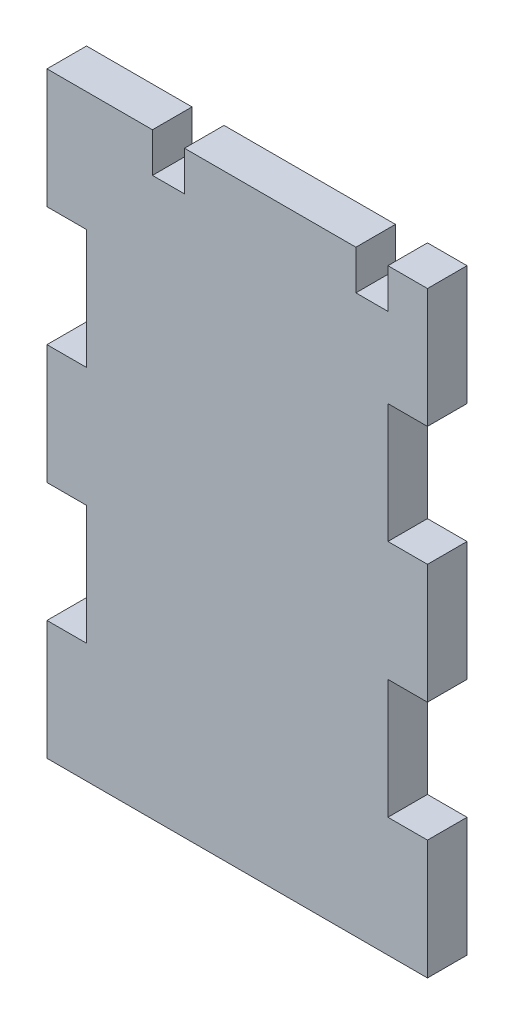
from build123d import *

# Parameters (mm, degrees)
SKETCH1_W           = 51.308
SKETCH1_H           = 80.518
BOSS_EXTRUDE1_DEPTH = 5.334
SKETCH2_W           = 5.334
SKETCH2_H           = 16.1036
CUT_EXTRUDE1_DEPTH  = 57.679185374
SKETCH3_W           = 4.318
SKETCH3_H           = 5.334
CUT_EXTRUDE2_DEPTH  = 57.679185374


with BuildPart() as part:
    # Sketch1 → Boss-Extrude1 (new body)
    with BuildSketch(Plane.XY):
        with Locations((-13.293278732, 0.572213281)):
            Rectangle(SKETCH1_W, SKETCH1_H)
    extrude(amount=BOSS_EXTRUDE1_DEPTH)

    # Sketch2 → Cut-Extrude1 (cut, through all)
    with BuildSketch(Plane.XY.offset(5.334)):
        with Locations((-36.280278732, 16.675813281)):
            Rectangle(SKETCH2_W, SKETCH2_H)
        with Locations((-36.280278732, -15.531386719)):
            Rectangle(SKETCH2_W, SKETCH2_H)
        with Locations((9.693721268, -15.531386719)):
            Rectangle(SKETCH2_W, SKETCH2_H)
        with Locations((9.693721268, 16.675813281)):
            Rectangle(SKETCH2_W, SKETCH2_H)
    extrude(amount=-CUT_EXTRUDE1_DEPTH, mode=Mode.SUBTRACT)

    # Sketch3 → Cut-Extrude2 (cut, through all)
    with BuildSketch(Plane.XY.offset(5.334)):
        with Locations((-22.564278732, 38.164213281)):
            Rectangle(SKETCH3_W, SKETCH3_H)
        with Locations((4.867721268, 38.164213281)):
            Rectangle(SKETCH3_W, SKETCH3_H)
    extrude(amount=-CUT_EXTRUDE2_DEPTH, mode=Mode.SUBTRACT)


solid = part.part
